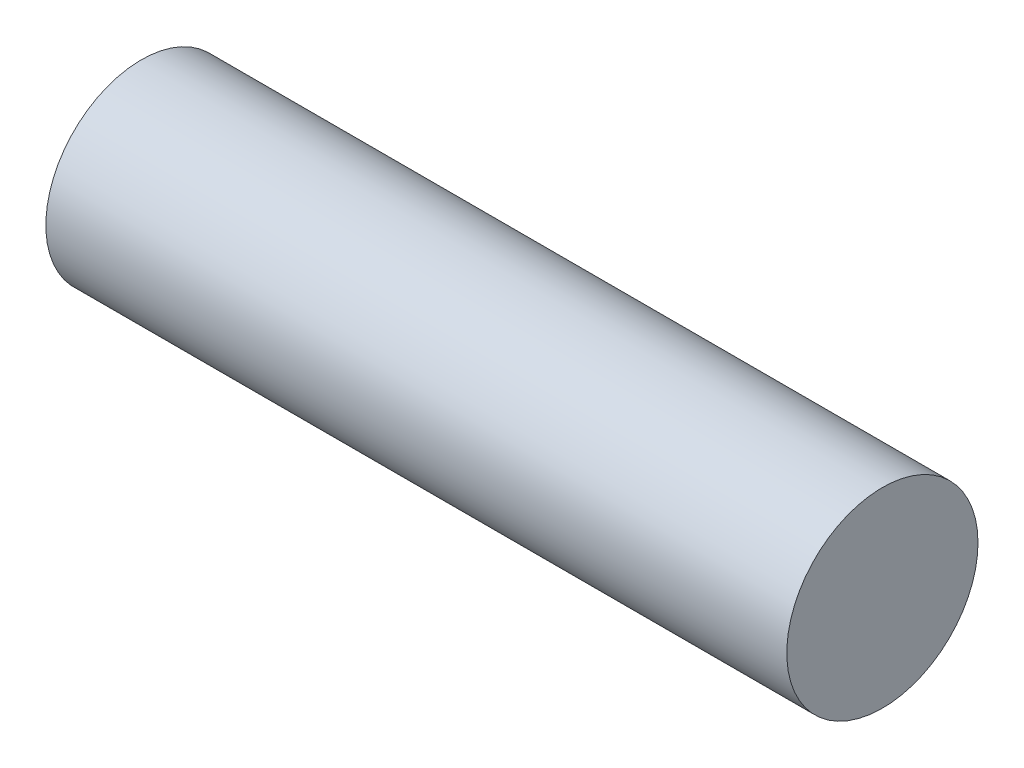
from build123d import *

# Parameters (mm, degrees)
SKETCH1_R           = 4
SKETCH1_R_2         = 3
BOSS_EXTRUDE1_DEPTH = 30
SKETCH3_R           = 4
BOSS_EXTRUDE2_DEPTH = 1


with BuildPart() as part:
    # Sketch1 → Boss-Extrude1 (new body)
    with BuildSketch(Plane.YZ):
        with Locations(Location((0, 0, 0), (0, 0, 270))):
            Circle(SKETCH1_R)
        with Locations(Location((0, 0, 0), (0, 0, 270))):
            Circle(SKETCH1_R_2, mode=Mode.SUBTRACT)
    extrude(amount=BOSS_EXTRUDE1_DEPTH)

    # Sketch3 → Boss-Extrude2 (add)
    with BuildSketch(Plane.YZ.offset(30)):
        with Locations(Location((0, 0, 0), (0, 0, 270))):
            Circle(SKETCH3_R)
    extrude(amount=BOSS_EXTRUDE2_DEPTH)


solid = part.part
